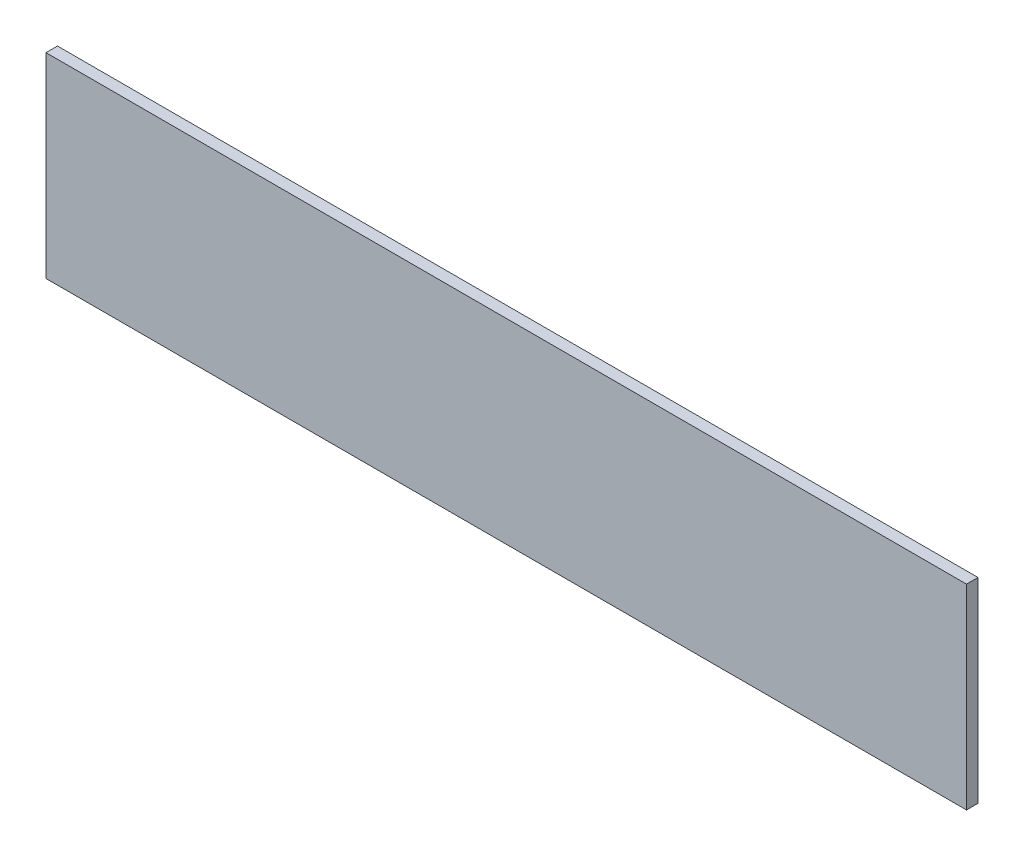
from build123d import *

# Parameters (mm, degrees)
SKIZZE1_W                       = 400
SKIZZE1_H                       = 85
AUFSATZ_LINEAR_AUSTRAGEN1_DEPTH = 5


with BuildPart() as part:
    # Skizze1 → Aufsatz-Linear austragen1 (new body)
    with BuildSketch(Plane.XY):
        with Locations((200, 42.5)):
            Rectangle(SKIZZE1_W, SKIZZE1_H)
    extrude(amount=AUFSATZ_LINEAR_AUSTRAGEN1_DEPTH)


solid = part.part
